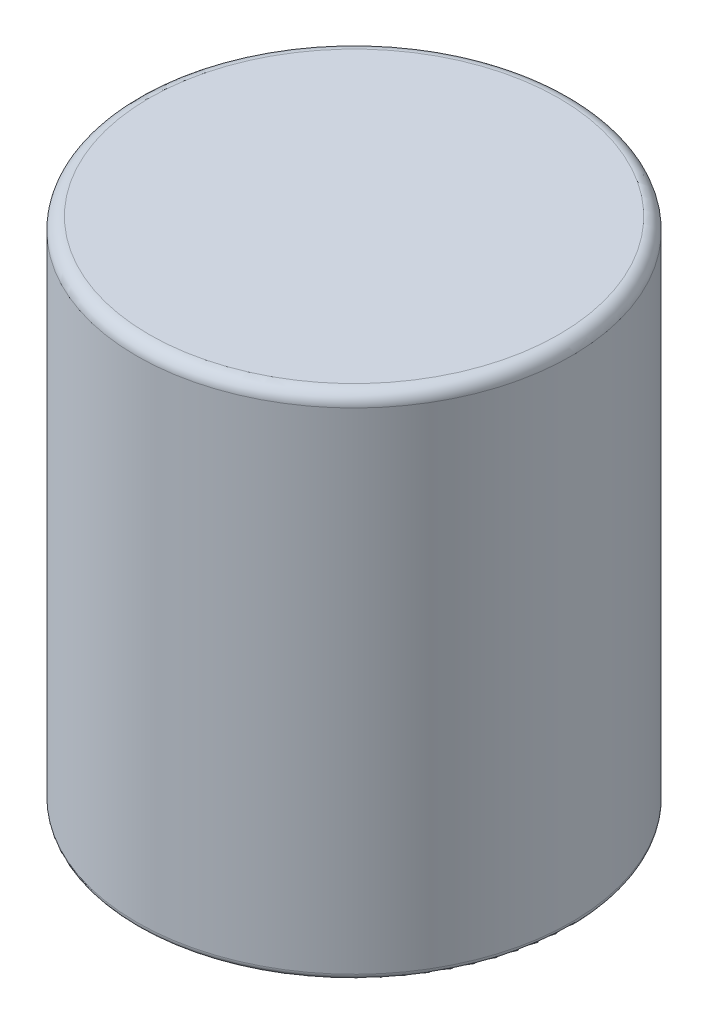
from build123d import *

# Parameters (mm, degrees)
SKETCH1_R           = 17.5
BOSS_EXTRUDE1_DEPTH = 41
FILLET2_R           = 1
SKETCH2_R           = 0.6
BOSS_EXTRUDE2_DEPTH = 5
FILLET3_R           = 0.5


with BuildPart() as part:
    # Sketch1 → Boss-Extrude1 (new body)
    with BuildSketch(Plane(origin=(0, 0, 0), x_dir=(1, 0, 0), z_dir=(0, 1, 0))):
        with Locations(Location((0, 0, 0), (0, 0, 270))):
            Circle(SKETCH1_R)
    extrude(amount=BOSS_EXTRUDE1_DEPTH)

    # Fillet2
    fillet2_edges = [part.edges().sort_by_distance(p)[0] for p in [
        (0, 41, -17.5),
    ]]
    fillet(fillet2_edges, radius=FILLET2_R)

    # Sketch2 → Boss-Extrude2 (add)
    with BuildSketch(Plane.XZ):
        with Locations(Location((0, 5, 0), (0, 0, 90))):
            Circle(SKETCH2_R)
        with Locations(Location((0, -5, 0), (0, 0, 90))):
            Circle(SKETCH2_R)
    extrude(amount=BOSS_EXTRUDE2_DEPTH)

    # Fillet3
    fillet3_edges = [part.edges().sort_by_distance(p)[0] for p in [
        (0, 0, -17.5),
    ]]
    fillet(fillet3_edges, radius=FILLET3_R)


solid = part.part
